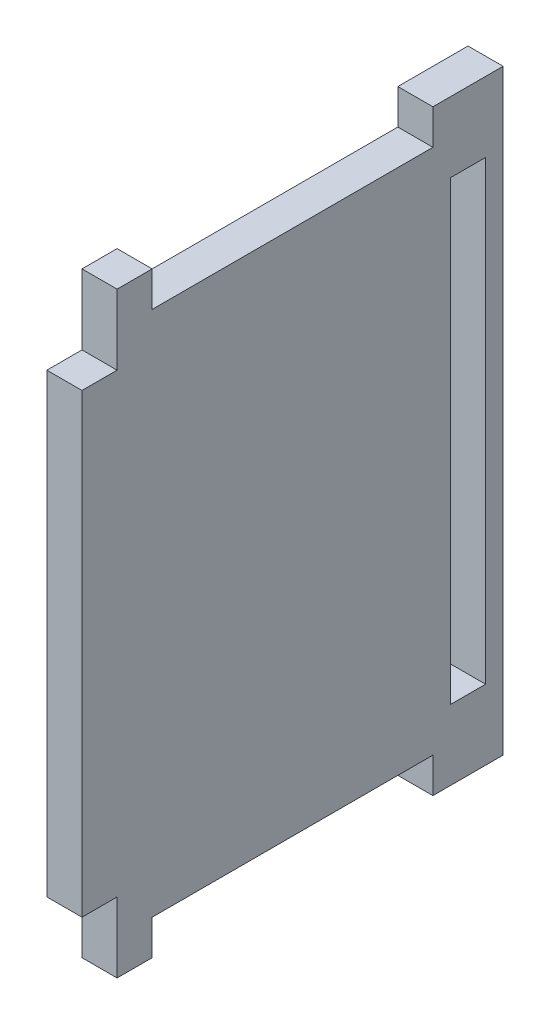
from build123d import *

# Parameters (mm, degrees)
SKETCH1_W           = 6.35
SKETCH1_H           = 107.95
BOSS_EXTRUDE1_DEPTH = 76.2
SKETCH2_W           = 6.35
SKETCH2_H           = 12.7
SKETCH2_W_2         = 50.8
SKETCH2_H_2         = 6.35
SKETCH2_H_3         = 82.55
CUT_EXTRUDE1_DEPTH  = 128.158650905


with BuildPart() as part:
    # Sketch1 → Boss-Extrude1 (new body)
    with BuildSketch(Plane.XY):
        with Locations((79.375, 47.625)):
            Rectangle(SKETCH1_W, SKETCH1_H)
    extrude(amount=BOSS_EXTRUDE1_DEPTH)

    # Sketch2 → Cut-Extrude1 (cut, through all)
    with BuildSketch(Plane(origin=(82.55, 0, 0), x_dir=(0, 0, -1), z_dir=(1, 0, 0))):
        with Locations((-73.025, 95.25)):
            Rectangle(SKETCH2_W, SKETCH2_H)
        with Locations((-73.025, 0)):
            Rectangle(SKETCH2_W, SKETCH2_H)
        with Locations((-38.1, 98.425)):
            Rectangle(SKETCH2_W_2, SKETCH2_H_2)
        with Locations((-6.35, 47.625)):
            Rectangle(SKETCH2_W, SKETCH2_H_3)
        with Locations((-38.1, -3.175)):
            Rectangle(SKETCH2_W_2, SKETCH2_H_2)
    extrude(amount=-CUT_EXTRUDE1_DEPTH, mode=Mode.SUBTRACT)


solid = part.part
